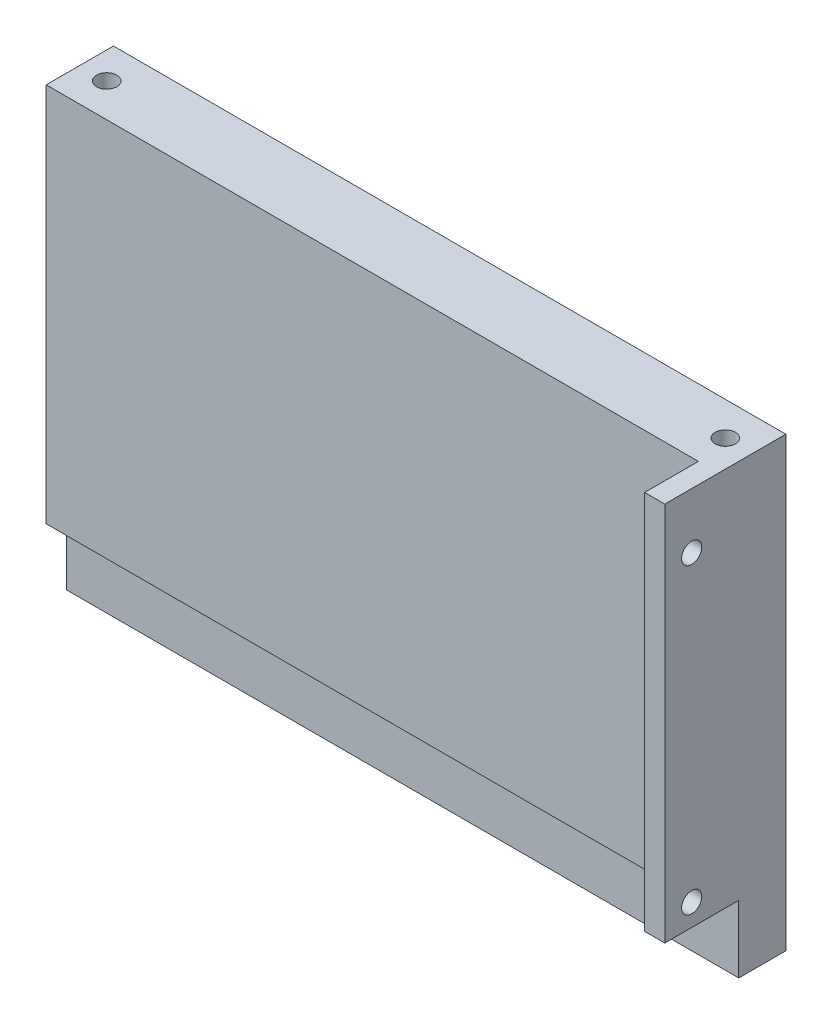
from build123d import *

# Parameters (mm, degrees)
SKETCH1_W           = 100
SKETCH1_H           = 10
BOSS_EXTRUDE1_DEPTH = 66.54
CUT_EXTRUDE1_REACH  = 85.382
SKETCH2_R           = 1.5
LPATTERN1_COUNT     = 2
LPATTERN1_PITCH     = 92
SKETCH3_W           = 100
SKETCH3_H           = 10
CUT_EXTRUDE2_DEPTH  = 3
SKETCH4_W           = 3
SKETCH4_H           = 56.54
BOSS_EXTRUDE2_DEPTH = 8
CUT_EXTRUDE3_REACH  = 122.816
SKETCH5_R           = 1.5


with BuildPart() as part:
    # Sketch1 → Boss-Extrude1 (new body)
    with BuildSketch(Plane(origin=(0, 0, 0), x_dir=(1, 0, 0), z_dir=(0, 1, 0))):
        Rectangle(SKETCH1_W, SKETCH1_H)
    extrude(amount=BOSS_EXTRUDE1_DEPTH)

    # Sketch2 → Cut-Extrude1 (cut, up to next)
    with BuildSketch(Plane(origin=(0, 66.54, 0), x_dir=(1, 0, 0), z_dir=(0, 1, 0)), mode=Mode.PRIVATE) as cut_extrude1_sk1:
        with Locations(Location((-46, 0, 0), (0, 0, 270))):
            Circle(SKETCH2_R)
    cut_extrude1_tool1 = extrude(cut_extrude1_sk1.sketch, amount=-CUT_EXTRUDE1_REACH, mode=Mode.PRIVATE) & part.part
    cut_extrude1 = cut_extrude1_tool1.solids().sort_by_distance((-46, 66.54, 0))[0]
    add(cut_extrude1, mode=Mode.SUBTRACT)

    # LPattern1: Cut-Extrude1 ×2
    with Locations(*[(i * LPATTERN1_PITCH, 0, 0) for i in range(1, LPATTERN1_COUNT)]):
        add(cut_extrude1, mode=Mode.SUBTRACT)

    # Sketch3 → Cut-Extrude2 (cut)
    with BuildSketch(Plane.XY.offset(5)):
        with Locations((0, 5)):
            Rectangle(SKETCH3_W, SKETCH3_H)
    extrude(amount=-CUT_EXTRUDE2_DEPTH, mode=Mode.SUBTRACT)

    # Sketch4 → Boss-Extrude2 (add)
    with BuildSketch(Plane.XY.offset(5)):
        with Locations((48.5, 38.27)):
            Rectangle(SKETCH4_W, SKETCH4_H)
    extrude(amount=BOSS_EXTRUDE2_DEPTH)

    # Sketch5 → Cut-Extrude3 (cut, up to next)
    with BuildSketch(Plane(origin=(50, 0, 0), x_dir=(0, 0, -1), z_dir=(1, 0, 0)), mode=Mode.PRIVATE) as cut_extrude3_sk1:
        with Locations((-9, 58.27)):
            Circle(SKETCH5_R)
    cut_extrude3_tool1 = extrude(cut_extrude3_sk1.sketch, amount=-CUT_EXTRUDE3_REACH, mode=Mode.PRIVATE) & part.part
    # Sketch5 → Cut-Extrude3 (cut, up to next)
    with BuildSketch(Plane(origin=(50, 0, 0), x_dir=(0, 0, -1), z_dir=(1, 0, 0)), mode=Mode.PRIVATE) as cut_extrude3_sk2:
        with Locations((-9, 13.27)):
            Circle(SKETCH5_R)
    cut_extrude3_tool2 = extrude(cut_extrude3_sk2.sketch, amount=-CUT_EXTRUDE3_REACH, mode=Mode.PRIVATE) & part.part
    add(cut_extrude3_tool1.solids().sort_by_distance((50, 58.27, 9))[0], mode=Mode.SUBTRACT)
    add(cut_extrude3_tool2.solids().sort_by_distance((50, 13.27, 9))[0], mode=Mode.SUBTRACT)


solid = part.part
